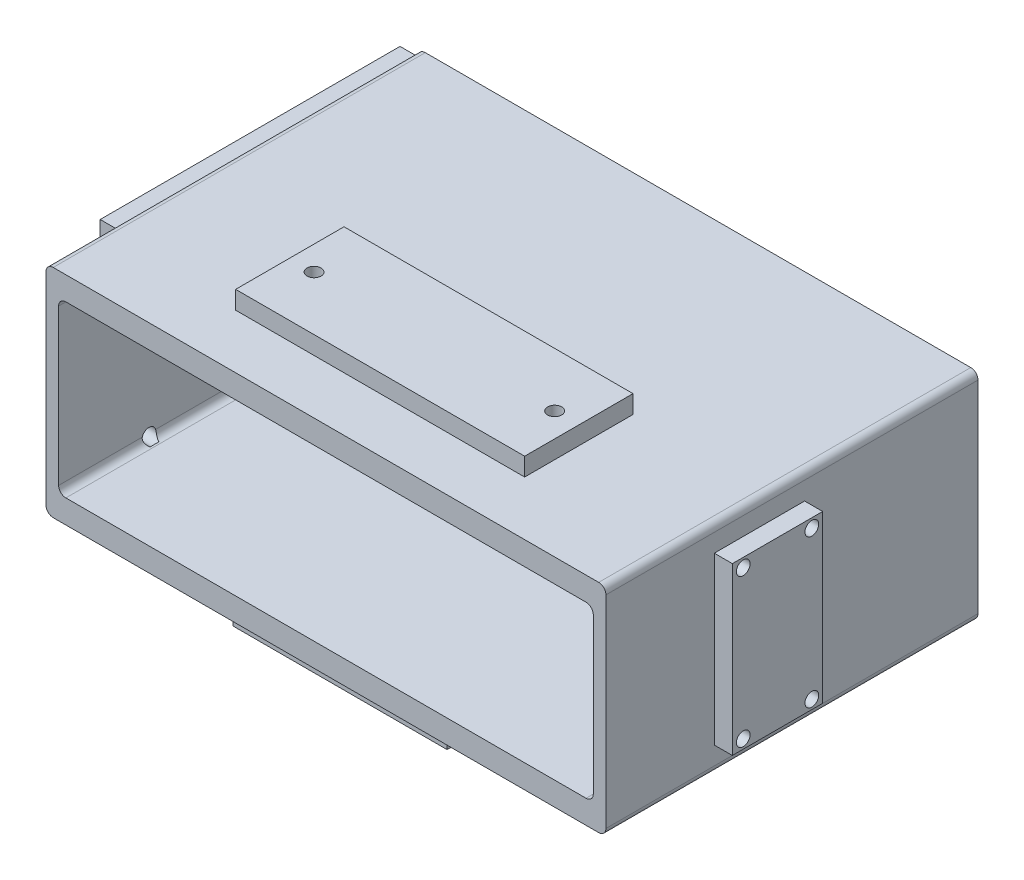
from build123d import *

# Parameters (mm, degrees)
SKETCH_1_W           = 155
SKETCH_1_H           = 60
EXTRUDE_1_DEPTH      = 3
SKETCH_2_W           = 155
SKETCH_2_H           = 60
SKETCH_2_W_2         = 148
SKETCH_2_H_2         = 47
EXTRUDE_2_DEPTH      = 90
FILLET_1_R           = 2
SKETCH_5_R           = 1.9
CUT_EXTRUDE_2_DEPTH  = 3
SKETCH_6_R           = 1.9
CUT_EXTRUDE_3_DEPTH  = 5
EXTRUDE_START        = 10
SKETCH_9_R           = 1.9
EXTRUDE_3_DEPTH      = 10
EXTRUDE_START_2      = 5
SKETCH_10_W          = 83
SKETCH_10_H          = 56
SKETCH_10_R          = 1.9
EXTRUDE_4_DEPTH      = 5
SKETCH_7_R           = 1.9
CUT_EXTRUDE_5_DEPTH  = 5
SKETCH_13_W          = 59.21
SKETCH_13_H          = 99.08
SKETCH_13_R          = 1.9
EXTRUDE_5_DEPTH      = 5
SKETCH_18_W          = 25
SKETCH_18_H          = 46
EXTRUDE_8_DEPTH      = 5
SKETCH_19_R          = 1.9
CUT_EXTRUDE_8_DEPTH  = 10
SKETCH_21_W          = 80
SKETCH_21_H          = 30
EXTRUDE_9_DEPTH      = 5
SKETCH_22_R          = 1.95
CUT_EXTRUDE_9_DEPTH  = 7
CUT_EXTRUDE_10_DEPTH = 5


with BuildPart() as part:
    # 草图1 → 凸台-拉伸1 (new body)
    with BuildSketch(Plane.XY):
        Rectangle(SKETCH_1_W, SKETCH_1_H)
    extrude(amount=EXTRUDE_1_DEPTH)

    # 草图2 → 凸台-拉伸2 (add)
    with BuildSketch(Plane.XY.offset(3)):
        Rectangle(SKETCH_2_W, SKETCH_2_H)
        Rectangle(SKETCH_2_W_2, SKETCH_2_H_2, mode=Mode.SUBTRACT)
    extrude(amount=EXTRUDE_2_DEPTH)

    # 圆角1
    fillet_1_edges = [part.edges().sort_by_distance(p)[0] for p in [
        (-77.5, 30, 46.5),
        (-77.5, -30, 46.5),
        (77.5, 30, 46.5),
        (77.5, -30, 46.5),
        (74, -23.5, 48),
        (-74, -23.5, 48),
        (74, 23.5, 48),
        (-74, 23.5, 48),
    ]]
    fillet(fillet_1_edges, radius=FILLET_1_R)

    # 草图5 → 切除-拉伸2 (cut)
    with BuildSketch(Plane(origin=(0, 0, 0), x_dir=(-1, 0, 0), z_dir=(0, 0, -1))):
        with Locations((-60, 15)):
            Circle(SKETCH_5_R)
        with Locations((-60, -15)):
            Circle(SKETCH_5_R)
        with Locations((-30, 15)):
            Circle(SKETCH_5_R)
        with Locations((-30, -15)):
            Circle(SKETCH_5_R)
        with Locations((0, 15)):
            Circle(SKETCH_5_R)
        with Locations((0, -15)):
            Circle(SKETCH_5_R)
        with Locations((30, 15)):
            Circle(SKETCH_5_R)
        with Locations((30, -15)):
            Circle(SKETCH_5_R)
        with Locations((60, 15)):
            Circle(SKETCH_5_R)
        with Locations((60, -15)):
            Circle(SKETCH_5_R)
    extrude(amount=-CUT_EXTRUDE_2_DEPTH, mode=Mode.SUBTRACT)

    # 草图6 → 切除-拉伸3 (cut)
    with BuildSketch(Plane.ZY.offset(77.5)):
        with Locations((24, -22)):
            Circle(SKETCH_6_R)
        with Locations((68, -22)):
            Circle(SKETCH_6_R)
        with Locations((24, 22)):
            Circle(SKETCH_6_R)
        with Locations((68, 22)):
            Circle(SKETCH_6_R)
    extrude(amount=-CUT_EXTRUDE_3_DEPTH, mode=Mode.SUBTRACT)

    # 草图9 → 凸台-拉伸3 (add)
    with BuildSketch(Plane(origin=(0, 0, 0), x_dir=(-1, 0, 0), z_dir=(0, 0, -1)).offset(EXTRUDE_START)):
        with BuildLine():
            Line((77.5, -28), (77.5, 28))
            ThreePointArc((77.5, 28), (76.914213562, 29.414213562), (75.5, 30))
            Line((75.5, 30), (-75.5, 30))
            ThreePointArc((-75.5, 30), (-76.914213562, 29.414213562), (-77.5, 28))
            Line((-77.5, 28), (-77.5, -28))
            ThreePointArc((-77.5, -28), (-76.914213562, -29.414213562), (-75.5, -30))
            Line((-75.5, -30), (75.5, -30))
            ThreePointArc((75.5, -30), (76.914213562, -29.414213562), (77.5, -28))
        make_face()
        with Locations((-60, 15)):
            Circle(SKETCH_9_R, mode=Mode.SUBTRACT)
        with Locations((60, -15)):
            Circle(SKETCH_9_R, mode=Mode.SUBTRACT)
        with Locations((-60, -15)):
            Circle(SKETCH_9_R, mode=Mode.SUBTRACT)
        with Locations((-30, -15)):
            Circle(SKETCH_9_R, mode=Mode.SUBTRACT)
        with Locations((-30, 15)):
            Circle(SKETCH_9_R, mode=Mode.SUBTRACT)
        with Locations((0, 15)):
            Circle(SKETCH_9_R, mode=Mode.SUBTRACT)
        with Locations((60, 15)):
            Circle(SKETCH_9_R, mode=Mode.SUBTRACT)
        with Locations((30, -15)):
            Circle(SKETCH_9_R, mode=Mode.SUBTRACT)
        with Locations((30, 15)):
            Circle(SKETCH_9_R, mode=Mode.SUBTRACT)
        with Locations((0, -15)):
            Circle(SKETCH_9_R, mode=Mode.SUBTRACT)
    extrude(amount=-EXTRUDE_3_DEPTH)

    # 草图10 → 凸台-拉伸4 (add)
    with BuildSketch(Plane.ZY.offset(77.5).offset(EXTRUDE_START_2)):
        with Locations((31.5, 0)):
            Rectangle(SKETCH_10_W, SKETCH_10_H)
        with Locations((24, -22)):
            Circle(SKETCH_10_R, mode=Mode.SUBTRACT)
        with Locations((24, 22)):
            Circle(SKETCH_10_R, mode=Mode.SUBTRACT)
        with Locations((68, -22)):
            Circle(SKETCH_10_R, mode=Mode.SUBTRACT)
        with Locations((68, 22)):
            Circle(SKETCH_10_R, mode=Mode.SUBTRACT)
    extrude(amount=-EXTRUDE_4_DEPTH)

    # 草图7 → 切除-拉伸5 (cut)
    with BuildSketch(Plane.XZ.offset(30)):
        with Locations((-24.605, -3)):
            Circle(SKETCH_7_R)
        with Locations((-24.605, 84.08)):
            Circle(SKETCH_7_R)
        with Locations((24.605, -3)):
            Circle(SKETCH_7_R)
        with Locations((24.605, 84.08)):
            Circle(SKETCH_7_R)
    extrude(amount=-CUT_EXTRUDE_5_DEPTH, mode=Mode.SUBTRACT)

    # 草图13 → 凸台-拉伸5 (add)
    with BuildSketch(Plane.XZ.offset(30).offset(EXTRUDE_START_2)):
        with Locations((0, 39.54)):
            Rectangle(SKETCH_13_W, SKETCH_13_H)
        with Locations((-24.605, -3)):
            Circle(SKETCH_13_R, mode=Mode.SUBTRACT)
        with Locations((24.605, -3)):
            Circle(SKETCH_13_R, mode=Mode.SUBTRACT)
        with Locations((24.605, 84.08)):
            Circle(SKETCH_13_R, mode=Mode.SUBTRACT)
        with Locations((-24.605, 84.08)):
            Circle(SKETCH_13_R, mode=Mode.SUBTRACT)
    extrude(amount=-EXTRUDE_5_DEPTH)

    # 草图18 → 凸台-拉伸8 (add)
    with BuildSketch(Plane(origin=(77.5, 0, 0), x_dir=(0, 0, -1), z_dir=(1, 0, 0))):
        with Locations((-50.5, 0)):
            Rectangle(SKETCH_18_W, SKETCH_18_H)
    extrude(amount=EXTRUDE_8_DEPTH)

    # 草图19 → 切除-拉伸8 (cut)
    with BuildSketch(Plane(origin=(82.5, 0, 0), x_dir=(0, 0, -1), z_dir=(1, 0, 0))):
        with Locations((-60, 20.5)):
            Circle(SKETCH_19_R)
        with Locations((-41, 20.5)):
            Circle(SKETCH_19_R)
        with Locations((-60, -20.5)):
            Circle(SKETCH_19_R)
        with Locations((-41, -20.5)):
            Circle(SKETCH_19_R)
    extrude(amount=-CUT_EXTRUDE_8_DEPTH, mode=Mode.SUBTRACT)

    # 草图21 → 凸台-拉伸9 (add)
    with BuildSketch(Plane(origin=(0, 30, 0), x_dir=(1, 0, 0), z_dir=(0, 1, 0))):
        with Locations((0, -63)):
            Rectangle(SKETCH_21_W, SKETCH_21_H)
    extrude(amount=EXTRUDE_9_DEPTH)

    # 草图22 → 切除-拉伸9 (cut)
    with BuildSketch(Plane(origin=(0, 35, 0), x_dir=(1, 0, 0), z_dir=(0, 1, 0))):
        with Locations((-33.3, -63)):
            Circle(SKETCH_22_R)
        with Locations((33.3, -63)):
            Circle(SKETCH_22_R)
    extrude(amount=-CUT_EXTRUDE_9_DEPTH, mode=Mode.SUBTRACT)

    # 草图24 → 切除-拉伸10 (cut)
    with BuildSketch(Plane.ZY.offset(82.5)):
        Polygon((28.5, 25), (28.5, 17.5), (21, 17.5), (21, -17.5), (28.5, -17.5), (28.5, -25), (63.5, -25), (63.5, -17.5), (71, -17.5), (71, 17.5), (63.5, 17.5), (63.5, 25), align=None)
    extrude(amount=-CUT_EXTRUDE_10_DEPTH, mode=Mode.SUBTRACT)


solid = part.part
